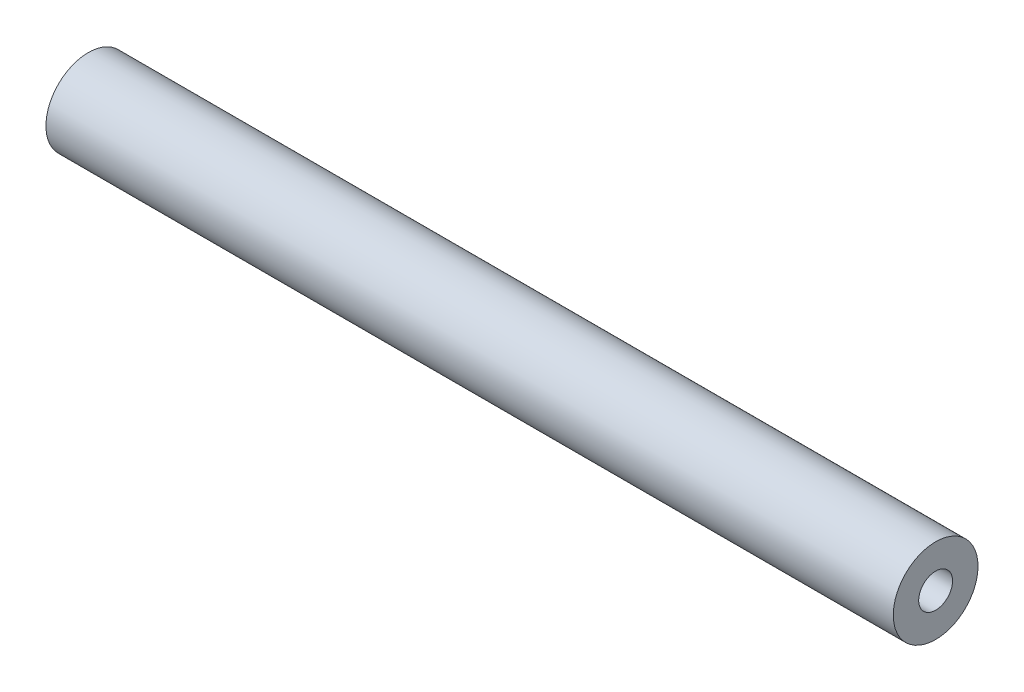
from build123d import *

# Parameters (mm, degrees)
SKETCH_1_R      = 5
SKETCH_1_R_2    = 2
EXTRUDE_1_DEPTH = 50


with BuildPart() as part:
    # 草图1 → 凸台-拉伸1 (new, symmetric)
    with BuildSketch(Plane(origin=(0, 0, 0), x_dir=(0, 0, -1), z_dir=(1, 0, 0))):
        Circle(SKETCH_1_R)
        Circle(SKETCH_1_R_2, mode=Mode.SUBTRACT)
    extrude(amount=EXTRUDE_1_DEPTH, both=True)


solid = part.part
